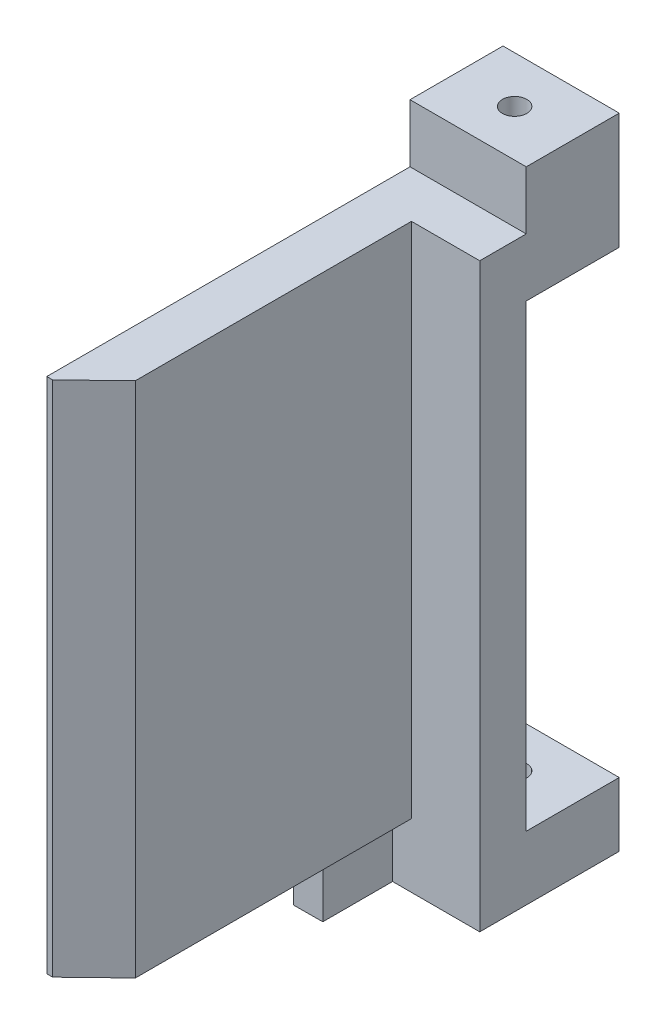
from build123d import *

# Parameters (mm, degrees)
SKETCH_1_R          = 2.1
EXTRUDE_1_DEPTH     = 11
EXTRUDE_2_DEPTH     = 79
SKETCH_3_R          = 2.1
EXTRUDE_3_DEPTH     = 10
EXTRUDE_START       = -10
SKETCH_3_2_R        = 2.1
EXTRUDE_4_DEPTH     = 10
CUT_EXTRUDE_6_DEPTH = 10


with BuildPart() as part:
    # Эскиз1 → Бобышка-Вытянуть1 (new body)
    with BuildSketch(Plane(origin=(0, 139.195974268, 0), x_dir=(1, 0, 0), z_dir=(0, 1, 0))):
        Polygon((21.558980694, -32.273129836), (1.558980694, -32.273129836), (1.558980694, -68.304125072), (6.558980694, -68.273129836), (6.558980694, -56.273129836), (21.558980694, -56.273129836), align=None)
        with Locations((11.55898069, -40.273129836)):
            Circle(SKETCH_1_R, mode=Mode.SUBTRACT)
    extrude(amount=EXTRUDE_1_DEPTH)

    # Эскиз2 → Бобышка-Вытянуть2 (add)
    with BuildSketch(Plane(origin=(0, 150.195974268, 0), x_dir=(1, 0, 0), z_dir=(0, 1, 0))):
        Polygon((1.558980694, -32.273129836), (4.558980694, -32.273129836), (4.558980694, -48.273129836), (21.558980694, -48.273129836), (21.558980694, -56.273129836), (9.808980694, -56.273129836), (9.808980694, -103.773129836), (2.558980694, -110.773129836), (1.558980694, -110.773129836), align=None)
    extrude(amount=EXTRUDE_2_DEPTH)



with BuildPart() as body_2:
    # Эскиз3 → Бобышка-Вытянуть3 (new body)
    with BuildSketch(Plane(origin=(0, 239.195974268, 0), x_dir=(1, 0, 0), z_dir=(0, 1, 0))):
        Polygon((1.558980694, -32.273129836), (1.558980694, -110.773129836), (2.558980694, -110.773129836), (9.808980694, -103.773129836), (9.808980694, -56.273129836), (21.558980694, -56.273129836), (21.558980694, -32.273129836), align=None)
        with Locations((11.55898069, -40.273129836)):
            Circle(SKETCH_3_R, mode=Mode.SUBTRACT)
    extrude(amount=EXTRUDE_3_DEPTH)


with BuildPart() as part_1:
    add(part.part)

    add(body_2.part)  # Бобышка-Вытянуть4 merges body 2
    # Эскиз3<2> → Бобышка-Вытянуть4 (add)
    with BuildSketch(Plane(origin=(0, 239.195974268, 0), x_dir=(1, 0, 0), z_dir=(0, 1, 0)).offset(EXTRUDE_START)):
        Polygon((1.558980694, -32.273129836), (1.558980694, -110.773129836), (2.558980694, -110.773129836), (9.808980694, -103.773129836), (9.808980694, -56.273129836), (21.558980694, -56.273129836), (21.558980694, -32.273129836), align=None)
        with Locations((11.55898069, -40.273129836)):
            Circle(SKETCH_3_2_R, mode=Mode.SUBTRACT)
    extrude(amount=EXTRUDE_4_DEPTH)

    # Эскиз5 → Вырез-Вытянуть6 (cut)
    with BuildSketch(Plane(origin=(0, 249.195974268, 0), x_dir=(1, 0, 0), z_dir=(0, 1, 0))):
        Polygon((1.558980694, -110.773129836), (1.558980694, -48.273129836), (21.558980694, -48.273129836), (21.558980694, -56.273129836), (9.808980694, -56.273129836), (9.808980694, -103.773129836), (2.558980694, -110.773129836), align=None)
    extrude(amount=-CUT_EXTRUDE_6_DEPTH, mode=Mode.SUBTRACT)


solid = part_1.part
